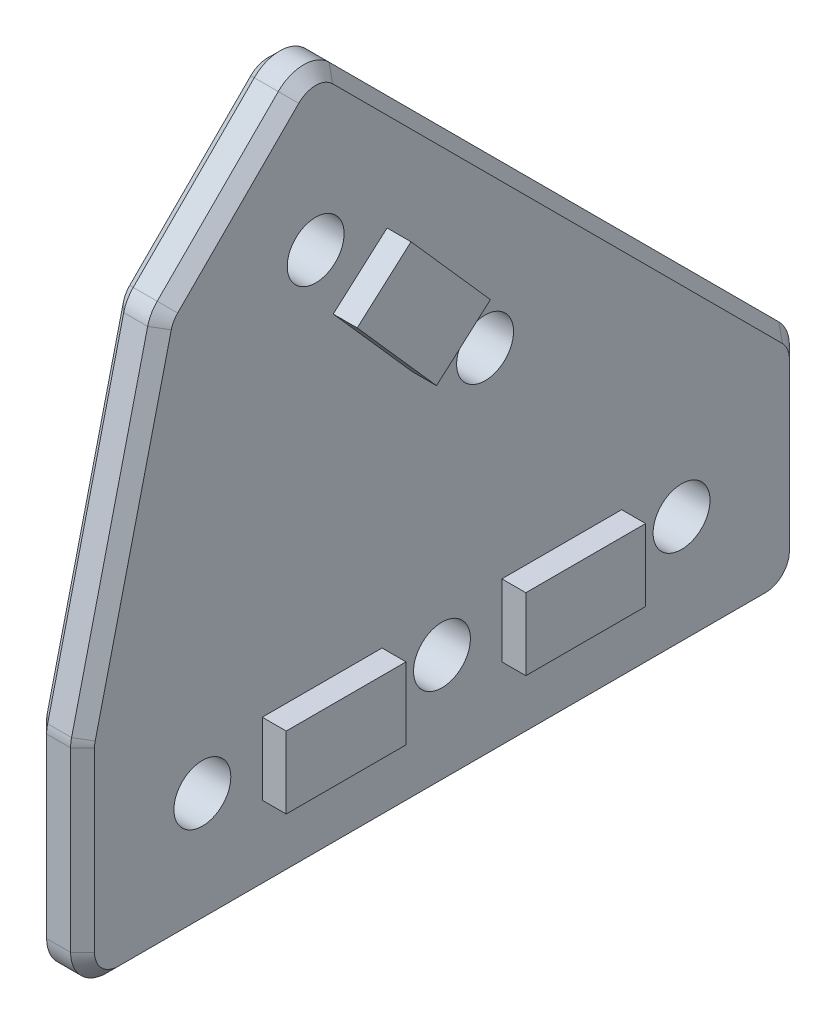
from build123d import *

# Parameters (mm, degrees)
BOSS_EXTRUDE1_DEPTH      = 4
SKETCH2_R                = 2.375
CUT_EXTRUDE1_DEPTH       = 98.803788642
LPATTERN1_COUNT          = 3
LPATTERN1_PITCH          = 20
SKETCH2_4_R              = 2.375
CUT_EXTRUDE2_DEPTH       = 98.803788642
LPATTERN2_COUNT          = 2
LPATTERN2_PITCH          = 20
FILLET1_R                = 3
CHANFRO1_SIZE            = 1
ESBO_O1_W                = 10
ESBO_O1_H                = 6
RESSALTO_EXTRUS_O1_DEPTH = 2


with BuildPart() as part:
    # Sketch1 → Boss-Extrude1 (new body)
    with BuildSketch(Plane(origin=(0, 0, 0), x_dir=(0, 0, -1), z_dir=(1, 0, 0))):
        Polygon((-78.140120378, 0), (-18.140120378, 0), (-18.140120378, 18.140120378), (-58.68306962, 58.68306962), (-71.510071751, 45.856067489), (-78.140120378, 18.140120378), align=None)
    extrude(amount=BOSS_EXTRUDE1_DEPTH)

    # Sketch2 → Cut-Extrude1 (cut, through all)
    with BuildSketch(Plane(origin=(4, 0, 0), x_dir=(0, 0, -1), z_dir=(1, 0, 0))):
        with Locations((-28.140120378, 10)):
            Circle(SKETCH2_R)
    cut_extrude1 = extrude(amount=-CUT_EXTRUDE1_DEPTH, mode=Mode.SUBTRACT)

    # LPattern1: Cut-Extrude1 ×3
    with Locations(*[(0, 0, i * LPATTERN1_PITCH) for i in range(1, LPATTERN1_COUNT)]):
        add(cut_extrude1, mode=Mode.SUBTRACT)

    # Sketch2<4> → Cut-Extrude2 (cut, through all)
    with BuildSketch(Plane(origin=(4, 0, 0), x_dir=(0, 0, -1), z_dir=(1, 0, 0))):
        with Locations((-58.68306962, 44.540933996)):
            Circle(SKETCH2_4_R)
    cut_extrude2 = extrude(amount=-CUT_EXTRUDE2_DEPTH, mode=Mode.SUBTRACT)

    # LPattern2: Cut-Extrude2 ×2
    with Locations(*[Vector(0, -0.7071067811865476, -0.7071067811865476) * (i * LPATTERN2_PITCH) for i in range(1, LPATTERN2_COUNT)]):
        add(cut_extrude2, mode=Mode.SUBTRACT)

    # Fillet1
    fillet1_edges = [part.edges().sort_by_distance(p)[0] for p in [
        (2, 18.140120378, 78.140120378),
        (2, 45.856067489, 71.510071751),
        (2, 58.68306962, 58.68306962),
        (2, 18.140120378, 18.140120378),
        (2, 0, 18.140120378),
        (2, 0, 78.140120378),
    ]]
    fillet(fillet1_edges, radius=FILLET1_R)

    # Chanfro1
    chanfro1_edges = [part.edges().sort_by_distance(p)[0] for p in [
        (0, 0, 48.140120378),
        (4, 0, 48.140120378),
        (0, 10.393145239, 78.140120378),
        (0, 31.75807492, 74.882512025),
        (0, 51.508513622, 65.857625619),
        (0, 37.790274655, 37.790274655),
        (0, 9.948739845, 18.140120378),
        (0, 57.440428933, 58.68306962),
        (0, 18.045529988, 18.36848178),
        (0, 0.878679656, 19.018800034),
        (0, 45.798751214, 71.407627967),
        (0, 18.137684762, 78.119469645),
        (0, 0.878679656, 77.261440721),
        (4, 10.393145239, 78.140120378),
        (4, 9.948739845, 18.140120378),
        (4, 37.790274655, 37.790274655),
        (4, 51.508513622, 65.857625619),
        (4, 31.75807492, 74.882512025),
        (4, 57.440428933, 58.68306962),
        (4, 18.045529988, 18.36848178),
        (4, 0.878679656, 19.018800034),
        (4, 45.798751214, 71.407627967),
        (4, 18.137684762, 78.119469645),
        (4, 0.878679656, 77.261440721),
    ]]
    chamfer(chanfro1_edges, length=CHANFRO1_SIZE)

    # Esboço1 → Ressalto-extrusão1 (add)
    with BuildSketch(Plane(origin=(4, 0, 0), x_dir=(0, 0, -1), z_dir=(1, 0, 0))):
        Polygon((-57.21666665, 39.183379746), (-50.59244791, 31.692069708), (-46.097661887, 35.666600952), (-52.721880627, 43.15791099), align=None)
        with Locations((-58.140120378, 10)):
            Rectangle(ESBO_O1_W, ESBO_O1_H)
        with Locations((-38.140120378, 10)):
            Rectangle(ESBO_O1_W, ESBO_O1_H)
    extrude(amount=RESSALTO_EXTRUS_O1_DEPTH)


solid = part.part
